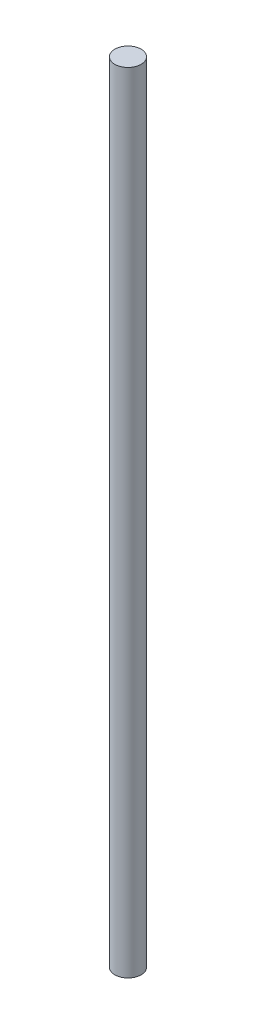
from build123d import *

# Parameters (mm, degrees)
BOSS_EXTRUDE1_DEPTH      = 60
BOSS_EXTRUDE1_DEPTH_BACK = 60
SKETCH1_R                = 2


with BuildPart() as part:
    # Sketch1 → Boss-Extrude1 (new, two sides: drawn at the far end of the back side and taken through both)
    with BuildSketch(Plane(origin=(0, 0, 0), x_dir=(1, 0, 0), z_dir=(0, 1, 0)).offset(-BOSS_EXTRUDE1_DEPTH_BACK)):
        Circle(SKETCH1_R)
    extrude(amount=BOSS_EXTRUDE1_DEPTH + BOSS_EXTRUDE1_DEPTH_BACK)


solid = part.part
